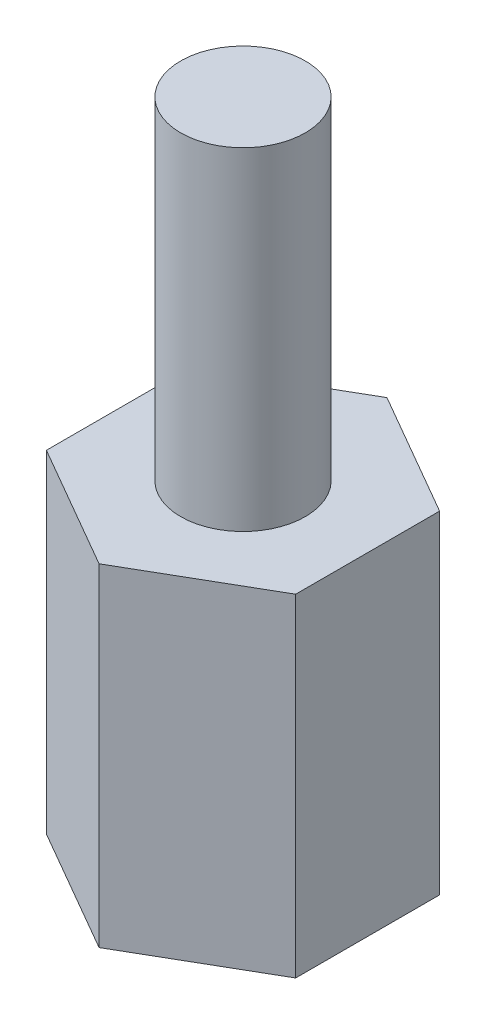
from build123d import *

# Parameters (mm, degrees)
SKETCH1_R           = 1.5
BOSS_EXTRUDE1_DEPTH = 8
BOSS_EXTRUDE2_START = -3
SKETCH2_R           = 1.5
BOSS_EXTRUDE2_DEPTH = 11


with BuildPart() as part:
    # Sketch1 → Boss-Extrude1 (new body)
    with BuildSketch(Plane(origin=(0, 0, 0), x_dir=(1, 0, 0), z_dir=(0, 1, 0))):
        Polygon((0, 3.464101615), (-3, 1.732050808), (-3, -1.732050808), (0, -3.464101615), (3, -1.732050808), (3, 1.732050808), align=None)
        with Locations(Location((0, 0, 0), (0, 0, 270))):
            Circle(SKETCH1_R, mode=Mode.SUBTRACT)
    extrude(amount=BOSS_EXTRUDE1_DEPTH)

    # Sketch2 → Boss-Extrude2 (add)
    with BuildSketch(Plane(origin=(0, 8, 0), x_dir=(1, 0, 0), z_dir=(0, 1, 0)).offset(BOSS_EXTRUDE2_START)):
        with Locations(Location((0, 0, 0), (0, 0, 270))):
            Circle(SKETCH2_R)
    extrude(amount=BOSS_EXTRUDE2_DEPTH)


solid = part.part
